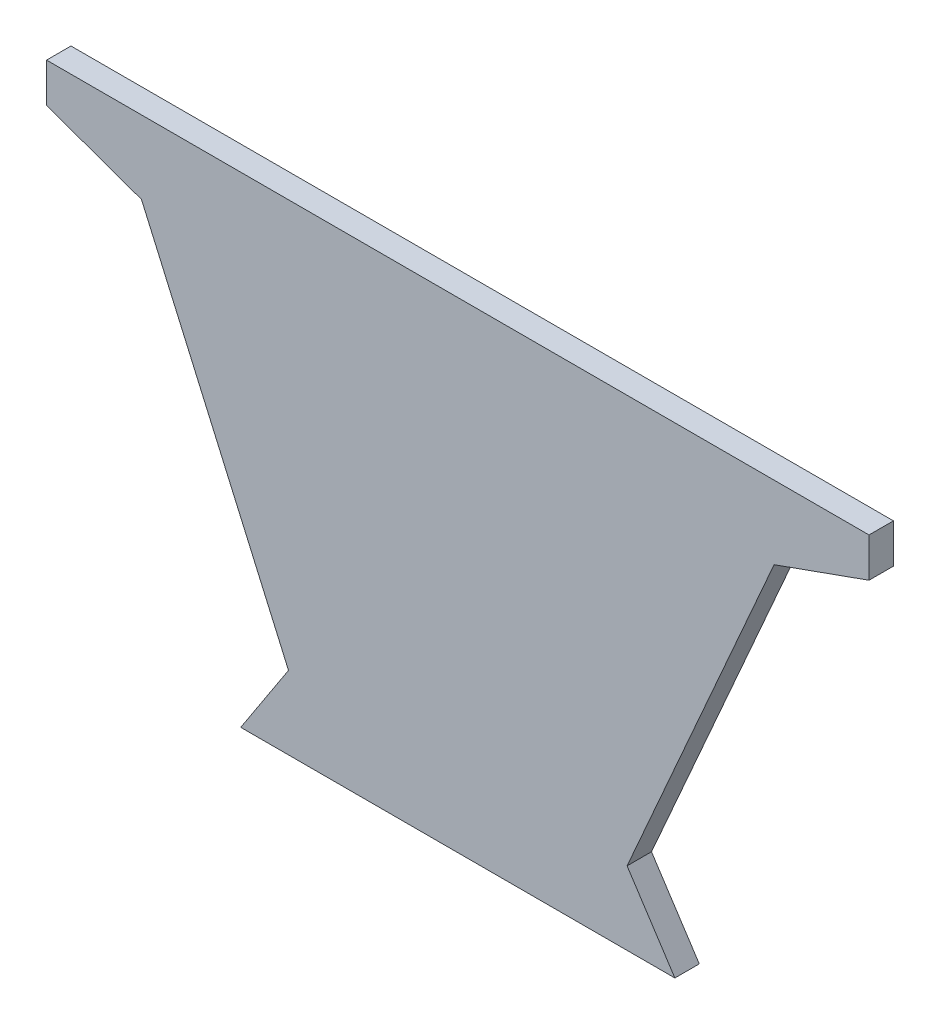
from build123d import *

# Parameters (mm, degrees)
BOSS_EXTRUDE1_DEPTH = 5
CUT_EXTRUDE1_DEPTH  = 10


with BuildPart() as part:
    # Sketch1 → Boss-Extrude1 (new body)
    with BuildSketch(Plane.XY):
        Polygon((-84.25, 41.208366892), (-44.473549128, -49.25), (44.473549128, -49.25), (84.25, 41.208366892), (84.25, 49.25), (-84.25, 49.25), align=None)
    extrude(amount=BOSS_EXTRUDE1_DEPTH)

    # Sketch2 → Cut-Extrude1 (cut)
    with BuildSketch(Plane(origin=(0, 0, 0), x_dir=(-1, 0, 0), z_dir=(0, 0, -1))):
        Polygon((44.473549128, -49.25), (34.683249526, -34.25), (64.804143572, 34.25), (84.25, 41.208366892), align=None)
        Polygon((-64.804143572, 34.25), (-34.683249526, -34.25), (-44.473549128, -49.25), (-84.25, 41.208366892), align=None)
    extrude(amount=-CUT_EXTRUDE1_DEPTH, mode=Mode.SUBTRACT)


solid = part.part
